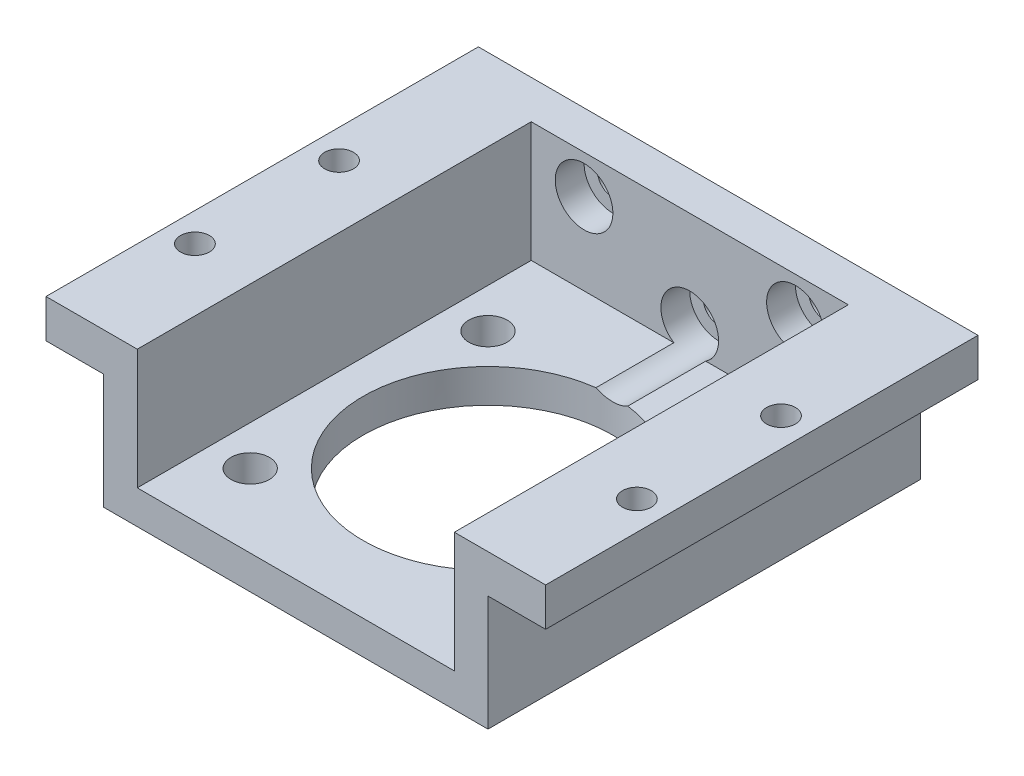
from build123d import *

# Parameters (mm, degrees)
EXTRUDE_1_DEPTH          = 40
SKETCH_2_R               = 13
CUT_EXTRUDE_1_DEPTH      = 1.5
SKETCH_3_R               = 13
CUT_EXTRUDE_2_DEPTH      = 50.862310416
CUT_EXTRUDE_3_REACH      = 52.319
SKETCH_4_R               = 2
PATTERN_CIRCULAR_1_COUNT = 4
SKETCH_5_R               = 1.5
CUT_EXTRUDE_4_DEPTH      = 49.744230428
SKETCH_6_W               = 33
SKETCH_6_H               = 40
CUT_EXTRUDE_5_DEPTH      = 1.5
SKETCH_7_W               = 6
SKETCH_7_H               = 40
CUT_EXTRUDE_6_DEPTH      = 2
EXTRUDE_2_DEPTH          = 5
SKETCH_9_W               = 33
SKETCH_9_H               = 4
EXTRUDE_3_DEPTH          = 12.5
SKETCH_10_R              = 1.6
CUT_EXTRUDE_7_DEPTH      = 4
CUT_EXTRUDE_START        = -3
SKETCH_11_R              = 3
SKETCH_11_R_2            = 1.6
CUT_EXTRUDE_8_DEPTH      = 3
SKETCH_12_R              = 3
CUT_EXTRUDE_9_DEPTH      = 14


with BuildPart() as part:
    # 草图1 → 凸台-拉伸1 (new body)
    with BuildSketch(Plane.XY):
        Polygon((-16.5, 27.398785639), (-16.5, 16.398785639), (16.5, 16.398785639), (16.5, 27.398785639), (26, 27.398785639), (26, 21.398785639), (20, 21.398785639), (20, 16.398785639), (20, 11.398785639), (-20, 11.398785639), (-20, 21.398785639), (-26, 21.398785639), (-26, 27.398785639), align=None)
    extrude(amount=EXTRUDE_1_DEPTH)

    # 草图2 → 切除-拉伸1 (cut)
    with BuildSketch(Plane.XZ.offset(-11.398785639)):
        with Locations(Location((0, 20, 0), (0, 0, 270))):
            Circle(SKETCH_2_R)
    extrude(amount=-CUT_EXTRUDE_1_DEPTH, mode=Mode.SUBTRACT)

    # 草图3 → 切除-拉伸2 (cut, through all)
    with BuildSketch(Plane.XZ.offset(-12.898785639)):
        with Locations(Location((0, 20, 0), (0, 0, 270))):
            Circle(SKETCH_3_R)
    extrude(amount=-CUT_EXTRUDE_2_DEPTH, mode=Mode.SUBTRACT)

    # 草图4 → 切除-拉伸3 (cut, up to next)
    with BuildSketch(Plane.XZ.offset(-11.398785639), mode=Mode.PRIVATE) as cut_extrude_3_sk1:
        with Locations(Location((12.374368671, 32.374368671, 0), (0, 0, 270))):
            Circle(SKETCH_4_R)
    cut_extrude_3_tool1 = extrude(cut_extrude_3_sk1.sketch, amount=-CUT_EXTRUDE_3_REACH, mode=Mode.PRIVATE) & part.part
    cut_extrude_3 = cut_extrude_3_tool1.solids().sort_by_distance((12.374369, 11.398786, 32.374369))[0]
    add(cut_extrude_3, mode=Mode.SUBTRACT)

    # 阵列(圆周)1: 切除-拉伸3 ×4 about axis
    pattern_circular_1_axis = Axis((0, 0, 20), (0, 1, 0))
    for i in range(1, PATTERN_CIRCULAR_1_COUNT):
        add(cut_extrude_3.rotate(pattern_circular_1_axis, i * 360 / PATTERN_CIRCULAR_1_COUNT), mode=Mode.SUBTRACT)

    # 草图5 → 切除-拉伸4 (cut, through all)
    with BuildSketch(Plane.XZ.offset(-21.398785639)):
        with Locations(Location((-23, 27.5, 0), (0, 0, 270))):
            Circle(SKETCH_5_R)
        with Locations(Location((-23, 12.5, 0), (0, 0, 270))):
            Circle(SKETCH_5_R)
    cut_extrude_4 = extrude(amount=-CUT_EXTRUDE_4_DEPTH, mode=Mode.SUBTRACT)

    # 镜向1: 切除-拉伸4 across plane
    add(cut_extrude_4.mirror(Plane.ZY), mode=Mode.SUBTRACT)

    # 草图6 → 切除-拉伸5 (cut)
    with BuildSketch(Plane(origin=(0, 16.398785639, 0), x_dir=(1, 0, 0), z_dir=(0, 1, 0))):
        with Locations((0, -20)):
            Rectangle(SKETCH_6_W, SKETCH_6_H)
    extrude(amount=-CUT_EXTRUDE_5_DEPTH, mode=Mode.SUBTRACT)

    # 草图7 → 切除-拉伸6 (cut)
    with BuildSketch(Plane.XZ.offset(-21.398785639)):
        with Locations((-23, 20)):
            Rectangle(SKETCH_7_W, SKETCH_7_H)
        with Locations((23, 20)):
            Rectangle(SKETCH_7_W, SKETCH_7_H)
    extrude(amount=-CUT_EXTRUDE_6_DEPTH, mode=Mode.SUBTRACT)

    # 草图8 → 凸台-拉伸2 (add)
    with BuildSketch(Plane.XY):
        Polygon((20, 11.398785639), (20, 23.398785639), (26, 23.398785639), (26, 27.398785639), (16.5, 27.398785639), (16.5, 14.898785639), (-16.5, 14.898785639), (-16.5, 27.398785639), (-26, 27.398785639), (-26, 23.398785639), (-20, 23.398785639), (-20, 11.398785639), align=None)
    extrude(amount=-EXTRUDE_2_DEPTH)

    # 草图9 → 凸台-拉伸3 (add)
    with BuildSketch(Plane(origin=(0, 14.898785639, 0), x_dir=(1, 0, 0), z_dir=(0, 1, 0))):
        with Locations((0, 3)):
            Rectangle(SKETCH_9_W, SKETCH_9_H)
    extrude(amount=EXTRUDE_3_DEPTH)

    # 草图10 → 切除-拉伸7 (cut)
    with BuildSketch(Plane(origin=(0, 0, -5), x_dir=(-1, 0, 0), z_dir=(0, 0, -1))):
        with Locations((-11, 23.398785639)):
            Circle(SKETCH_10_R)
        with Locations((0, 17.398785639)):
            Circle(SKETCH_10_R)
        with Locations((11, 23.398785639)):
            Circle(SKETCH_10_R)
    extrude(amount=-CUT_EXTRUDE_7_DEPTH, mode=Mode.SUBTRACT)

    # 草图11 → 切除-拉伸8 (cut)
    # profile 1 of 3: a face of its own
    with BuildSketch(Plane.XY.offset(-1).offset(CUT_EXTRUDE_START)):
        with Locations((-11, 23.398785639)):
            Circle(SKETCH_11_R)
        with Locations(Location((-11, 23.398785639, 0), (0, 0, 180))):
            Circle(SKETCH_11_R_2, mode=Mode.SUBTRACT)
    # profile 2 of 3: a face of its own
    with BuildSketch(Plane.XY.offset(-1).offset(CUT_EXTRUDE_START)):
        with Locations((0, 17.398785639)):
            Circle(SKETCH_11_R)
        with Locations(Location((0, 17.398785639, 0), (0, 0, 180))):
            Circle(SKETCH_11_R_2, mode=Mode.SUBTRACT)
    # profile 3 of 3: a face of its own
    with BuildSketch(Plane.XY.offset(-1).offset(CUT_EXTRUDE_START)):
        with Locations((11, 23.398785639)):
            Circle(SKETCH_11_R)
        with Locations(Location((11, 23.398785639, 0), (0, 0, 180))):
            Circle(SKETCH_11_R_2, mode=Mode.SUBTRACT)
    extrude(amount=CUT_EXTRUDE_8_DEPTH, mode=Mode.SUBTRACT)

    # 草图12 → 切除-拉伸9 (cut)
    with BuildSketch(Plane.XY.offset(-1)):
        with Locations((0, 17.398785639)):
            Circle(SKETCH_12_R)
    extrude(amount=CUT_EXTRUDE_9_DEPTH, mode=Mode.SUBTRACT)


solid = part.part
